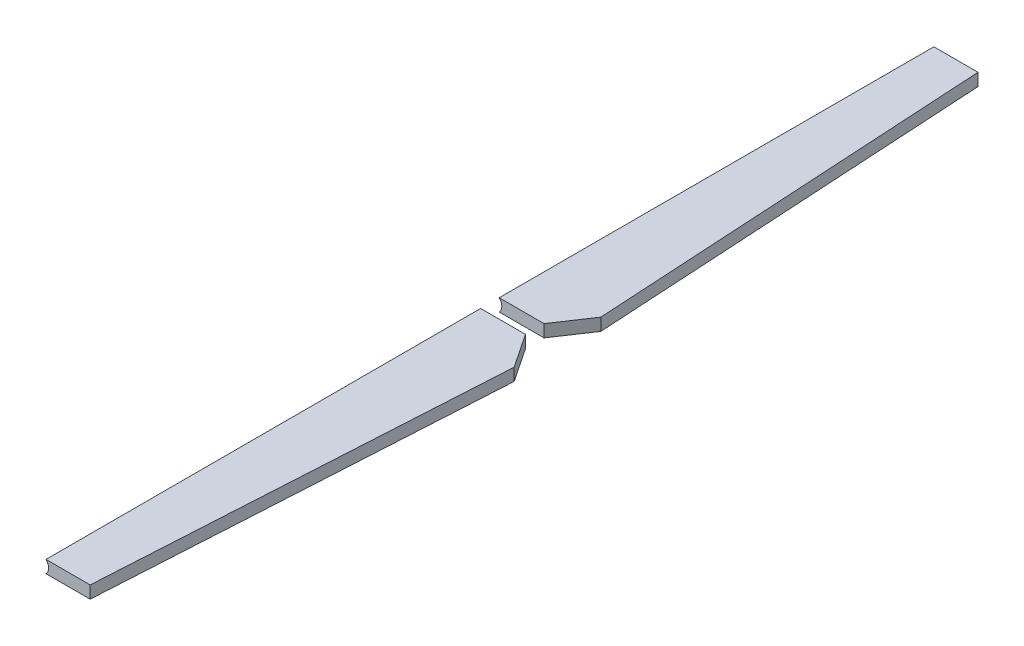
from build123d import *

# Parameters (mm, degrees)
BOSS_EXTRUDE1_DEPTH = 10
CUT_EXTRUDE1_DEPTH  = 356.209628619
SCALE3_SCALE        = 0.6


with BuildPart() as part:
    # Sketch1 → Boss-Extrude1 (new body)
    with BuildSketch(Plane(origin=(0, 0, 0), x_dir=(1, 0, 0), z_dir=(0, 1, 0))):
        Polygon((35.650600343, -358.35), (0, -358.35), (0, -7.5), (20.180404561, -7.5), (36.205984401, -7.5), (54.572500068, -34.997934227), align=None)
    extrude(amount=BOSS_EXTRUDE1_DEPTH)

    # Sketch2 → Cut-Extrude1 (cut, through all)
    with BuildSketch(Plane.XY.offset(358.35)):
        with BuildLine():
            Line((0, 10), (0, 0))
            ThreePointArc((0, 0), (2.071067812, 5), (0, 10))
        make_face()
    extrude(amount=-CUT_EXTRUDE1_DEPTH, mode=Mode.SUBTRACT)


with BuildPart() as part_1:
    # Scale3: scaled about (23.615874951, 5, 172.168463309)
    add(part.part.scale(SCALE3_SCALE).moved(Location((9.44634998, 2, 68.867385324))))


with BuildPart() as body_2:
    # Mirror3: mirrored copy
    add(part_1.part.mirror(Plane(origin=(0, 0, 68.867385324), x_dir=(1, 0, 0), z_dir=(0, 0, -1))))


solid = Compound([part_1.part, body_2.part])
